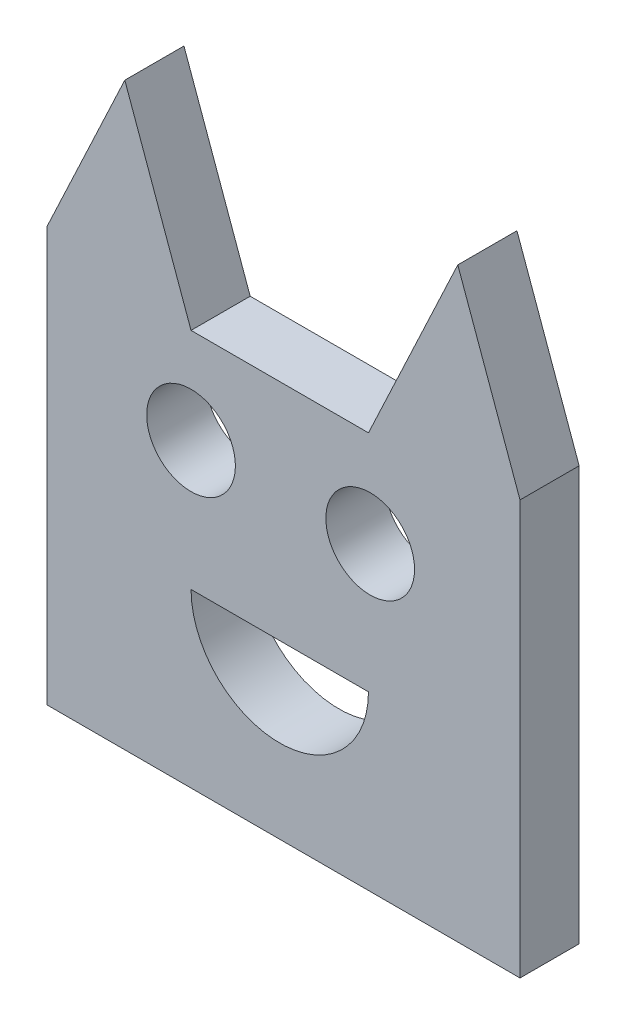
from build123d import *

# Parameters (mm, degrees)
SKETCH_1_R      = 7.5
EXTRUDE_1_DEPTH = 10


with BuildPart() as part:
    # 草圖1 → 填料-伸長1 (new body)
    with BuildSketch(Plane.XY):
        Polygon((-24.379405198, -67.016021468), (55.620594802, -67.016021468), (55.620594802, 2.983978532), (45.101238557, 32.144622287), (30, 0), (0, 0), (-11.19802439, 31.04197561), (-24.379405198, 2.983978532), align=None)
        with Locations((30.291786216, -16.110047004)):
            Circle(SKETCH_1_R, mode=Mode.SUBTRACT)
        with Locations((0, -16.110047004)):
            Circle(SKETCH_1_R, mode=Mode.SUBTRACT)
        with BuildLine():
            ThreePointArc((0, -37.928378378), (15, -52.928378378), (30, -37.928378378))
            Line((30, -37.928378378), (0, -37.928378378))
        make_face(mode=Mode.SUBTRACT)
    extrude(amount=-EXTRUDE_1_DEPTH)


solid = part.part
